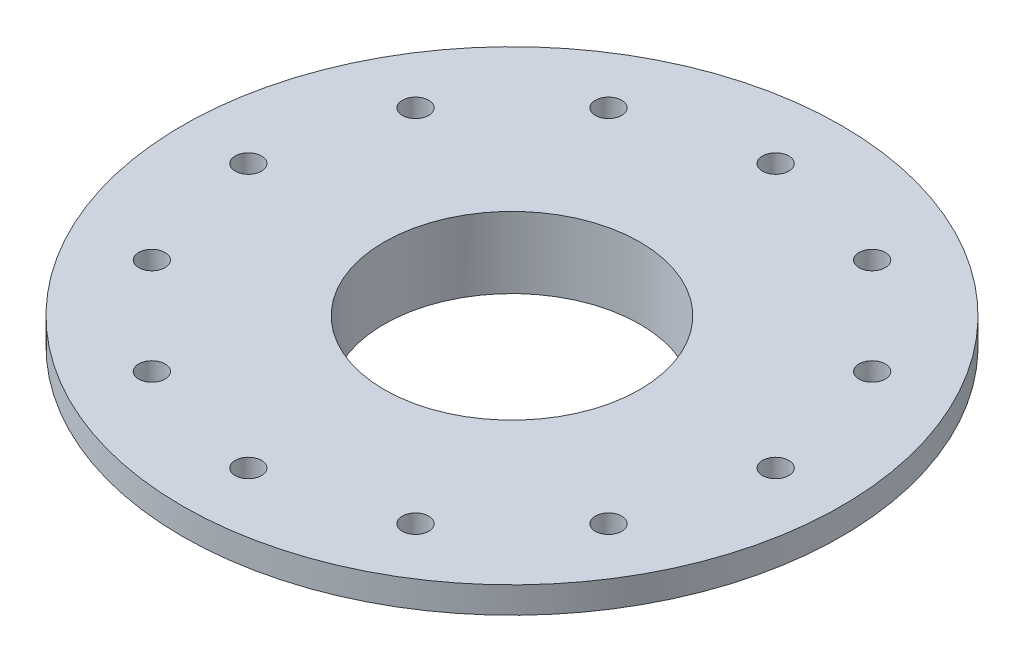
from build123d import *

# Parameters (mm, degrees)
SKETCH2_R           = 125
BOSS_EXTRUDE1_DEPTH = 10
SKETCH3_R           = 5
CUT_EXTRUDE1_DEPTH  = 10
SKETCH4_R           = 107.5
BOSS_EXTRUDE2_DEPTH = 17
CHAMFER1_SIZE       = 10
SKETCH5_R           = 48.5
CUT_EXTRUDE2_DEPTH  = 57


with BuildPart() as part:
    # Sketch2 → Boss-Extrude1 (new body)
    with BuildSketch(Plane(origin=(0, 0, 0), x_dir=(1, 0, 0), z_dir=(0, 1, 0))):
        with Locations(Location((0, 0, 0), (0, 0, 270))):
            Circle(SKETCH2_R)
    extrude(amount=BOSS_EXTRUDE1_DEPTH)

    # Sketch3 → Cut-Extrude1 (cut)
    with BuildSketch(Plane(origin=(0, 10, 0), x_dir=(1, 0, 0), z_dir=(0, 1, 0))):
        with Locations(Location((100, 0, 0), (0, 0, 270))):
            Circle(SKETCH3_R)
        with Locations(Location((86.602540378, -50, 0), (0, 0, 270))):
            Circle(SKETCH3_R)
        with Locations(Location((50, -86.602540378, 0), (0, 0, 270))):
            Circle(SKETCH3_R)
        with Locations(Location((0, -100, 0), (0, 0, 270))):
            Circle(SKETCH3_R)
        with Locations(Location((-50, -86.602540378, 0), (0, 0, 270))):
            Circle(SKETCH3_R)
        with Locations(Location((-86.602540378, -50, 0), (0, 0, 270))):
            Circle(SKETCH3_R)
        with Locations(Location((-100, 0, 0), (0, 0, 270))):
            Circle(SKETCH3_R)
        with Locations(Location((-86.602540378, 50, 0), (0, 0, 270))):
            Circle(SKETCH3_R)
        with Locations(Location((-50, 86.602540378, 0), (0, 0, 270))):
            Circle(SKETCH3_R)
        with Locations(Location((0, 100, 0), (0, 0, 270))):
            Circle(SKETCH3_R)
        with Locations(Location((50, 86.602540378, 0), (0, 0, 270))):
            Circle(SKETCH3_R)
        with Locations(Location((86.602540378, 50, 0), (0, 0, 270))):
            Circle(SKETCH3_R)
    extrude(amount=-CUT_EXTRUDE1_DEPTH, mode=Mode.SUBTRACT)

    # Sketch4 → Boss-Extrude2 (add)
    with BuildSketch(Plane.XZ):
        with Locations(Location((0, 0, 0), (0, 0, 270))):
            Circle(SKETCH4_R)
    extrude(amount=BOSS_EXTRUDE2_DEPTH)

    # Chamfer1
    chamfer1_edges = [part.edges().sort_by_distance(p)[0] for p in [
        (0, -17, 107.5),
    ]]
    chamfer(chamfer1_edges, length=CHAMFER1_SIZE)

    # Sketch5 → Cut-Extrude2 (cut)
    with BuildSketch(Plane.XZ.offset(17)):
        with Locations(Location((0, 0, 0), (0, 0, 270))):
            Circle(SKETCH5_R)
    extrude(amount=-CUT_EXTRUDE2_DEPTH, mode=Mode.SUBTRACT)


solid = part.part
